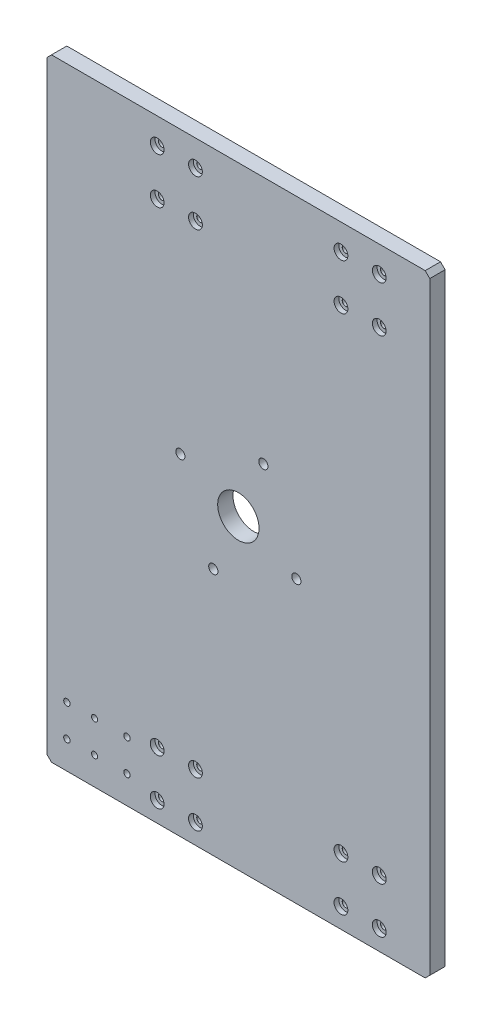
from build123d import *

# Parameters (mm, degrees)
ESQUISSE1_W                     = 250
ESQUISSE1_H                     = 400
BOSS_EXTRU_1_DEPTH              = 10
ESQUISSE2_R                     = 13.5
ENL_V_MAT_EXTRU_1_DEPTH         = 237.061432682
CHANFREIN1_SIZE                 = 3
TROU_TARAUD_M51_D               = 4.2
TROUS_DE_CENTRAGE_4_0MM2_D      = 4
TROUS_DE_CENTRAGE_6_0MM2_D      = 6
D_GAGEMENT_M41_D                = 4.5
R_P_TITION_LIN_AIRE1_COUNT      = 2
R_P_TITION_LIN_AIRE1_PITCH      = 120
R_P_TITION_LIN_AIRE1_COUNT_DIR2 = 2
R_P_TITION_LIN_AIRE1_PITCH_DIR2 = 340
R_P_TITION_LIN_AIRE2_COUNT      = 2
R_P_TITION_LIN_AIRE2_PITCH      = 30
R_P_TITION_LIN_AIRE2_COUNT_DIR2 = 2
R_P_TITION_LIN_AIRE2_PITCH_DIR2 = 25
R_P_TITION_LIN_AIRE3_COUNT      = 2
R_P_TITION_LIN_AIRE3_PITCH      = 120
R_P_TITION_LIN_AIRE3_COUNT_DIR2 = 2
R_P_TITION_LIN_AIRE3_PITCH_DIR2 = 340


with BuildPart() as part:
    # Esquisse1 → Boss.-Extru.1 (new body)
    with BuildSketch(Plane.XY):
        Rectangle(ESQUISSE1_W, ESQUISSE1_H)
    extrude(amount=BOSS_EXTRU_1_DEPTH)

    # Esquisse2 → Enlèv. mat.-Extru.1 (cut, through all)
    with BuildSketch(Plane(origin=(0, 0, 0), x_dir=(-1, 0, 0), z_dir=(0, 0, -1))):
        Circle(ESQUISSE2_R)
    extrude(amount=-ENL_V_MAT_EXTRU_1_DEPTH, mode=Mode.SUBTRACT)

    # Chanfrein1
    chanfrein1_edges = [part.edges().sort_by_distance(p)[0] for p in [
        (125, -200, 5),
        (-125, -200, 5),
        (-125, 200, 5),
        (125, 200, 5),
    ]]
    chamfer(chanfrein1_edges, length=CHANFREIN1_SIZE)

    # Trou taraudé M51 (through all)
    with Locations(Plane.XY.offset(10)):
        with Locations((-72.698486264, -161.07971462), (-72.698486264, -181.838730229), (-111.937151978, -181.838730229), (-111.937151978, -161.07971462)):
            Hole(TROU_TARAUD_M51_D / 2)

    # Trous de centrage Ø4.0mm2 (through all)
    with Locations(Plane.XY.offset(10)):
        with Locations((-93.86308218, -161.07971462), (-93.86308218, -181.838730229)):
            Hole(TROUS_DE_CENTRAGE_4_0MM2_D / 2)

    # Trous de centrage Ø6.0mm2 (through all)
    with Locations(Plane.XY.offset(10)):
        with Locations((16.357059687, 37.86831259), (37.86831259, -16.357059687), (-16.357059687, -37.86831259), (-37.86831259, 16.357059687)):
            Hole(TROUS_DE_CENTRAGE_6_0MM2_D / 2)

    # Dégagement M41 (through all)
    with Locations(Plane(origin=(0, 0, 0), x_dir=(-1, 0, 0), z_dir=(0, 0, -1))):
        with Locations((28, -187), (28, -157), (53, -157), (53, -187)):
            d_gagement_m41 = Hole(D_GAGEMENT_M41_D / 2)

    # Répétition linéaire1: D_gagement M41 2 × 2
    with Locations(*[(i * R_P_TITION_LIN_AIRE1_PITCH, j * R_P_TITION_LIN_AIRE1_PITCH_DIR2, 0) for i in range(R_P_TITION_LIN_AIRE1_COUNT) for j in range(R_P_TITION_LIN_AIRE1_COUNT_DIR2) if (i, j) != (0, 0)]):
        add(d_gagement_m41, mode=Mode.SUBTRACT)

    # Esquisse29 → Chambrage pour vis à tête ronde bombée M41 (revolve, cut)
    with BuildSketch(Plane(origin=(92, -157, 10), x_dir=(0, -1, 0), z_dir=(1, 0, 0))):
        Polygon((0, 0), (0, 10), (2.25, 10), (2.25, 3.125), (2.275, 3.1), (4.5, 3.1), (4.5, 0), align=None)
    chambrage_pour_vis_t_te_ronde_bomb_e_m = revolve(axis=Axis((92, -157, 16.35), (0, 0, -1)), mode=Mode.SUBTRACT)

    # Répétition linéaire2: Chambrage pour vis _ t_te ronde bomb_e M 2 × 2
    with Locations(*[(-j * R_P_TITION_LIN_AIRE2_PITCH_DIR2, -i * R_P_TITION_LIN_AIRE2_PITCH, 0) for i in range(R_P_TITION_LIN_AIRE2_COUNT) for j in range(R_P_TITION_LIN_AIRE2_COUNT_DIR2) if (i, j) != (0, 0)]):
        add(chambrage_pour_vis_t_te_ronde_bomb_e_m, mode=Mode.SUBTRACT)

    # Répétition linéaire3: Chambrage pour vis _ t_te ronde bomb_e M 2 × 2
    with Locations(*[(-i * R_P_TITION_LIN_AIRE3_PITCH, j * R_P_TITION_LIN_AIRE3_PITCH_DIR2, 0) for i in range(R_P_TITION_LIN_AIRE3_COUNT) for j in range(R_P_TITION_LIN_AIRE3_COUNT_DIR2) if (i, j) != (0, 0)]):
        add(chambrage_pour_vis_t_te_ronde_bomb_e_m, mode=Mode.SUBTRACT)

    # Répétition linéaire3 copy 1 sketch → Répétition linéaire3 copy 1 (revolve, cut)
    with BuildSketch(Plane(origin=(67, 183, 10), x_dir=(0, -1, 0), z_dir=(1, 0, 0))):
        Polygon((0, 0), (0, 10), (2.25, 10), (2.25, 3.125), (2.275, 3.1), (4.5, 3.1), (4.5, 0), align=None)
    revolve(axis=Axis((67, 183, 16.35), (0, 0, -1)), mode=Mode.SUBTRACT)

    # Répétition linéaire3 copy 2 sketch → Répétition linéaire3 copy 2 (revolve, cut)
    with BuildSketch(Plane(origin=(-53, -157, 10), x_dir=(0, -1, 0), z_dir=(1, 0, 0))):
        Polygon((0, 0), (0, 10), (2.25, 10), (2.25, 3.125), (2.275, 3.1), (4.5, 3.1), (4.5, 0), align=None)
    revolve(axis=Axis((-53, -157, 16.35), (0, 0, -1)), mode=Mode.SUBTRACT)

    # Répétition linéaire3 copy 3 sketch → Répétition linéaire3 copy 3 (revolve, cut)
    with BuildSketch(Plane(origin=(-53, 183, 10), x_dir=(0, -1, 0), z_dir=(1, 0, 0))):
        Polygon((0, 0), (0, 10), (2.25, 10), (2.25, 3.125), (2.275, 3.1), (4.5, 3.1), (4.5, 0), align=None)
    revolve(axis=Axis((-53, 183, 16.35), (0, 0, -1)), mode=Mode.SUBTRACT)

    # Répétition linéaire3 copy 4 sketch → Répétition linéaire3 copy 4 (revolve, cut)
    with BuildSketch(Plane(origin=(92, 153, 10), x_dir=(0, -1, 0), z_dir=(1, 0, 0))):
        Polygon((0, 0), (0, 10), (2.25, 10), (2.25, 3.125), (2.275, 3.1), (4.5, 3.1), (4.5, 0), align=None)
    revolve(axis=Axis((92, 153, 16.35), (0, 0, -1)), mode=Mode.SUBTRACT)

    # Répétition linéaire3 copy 5 sketch → Répétition linéaire3 copy 5 (revolve, cut)
    with BuildSketch(Plane(origin=(-28, -187, 10), x_dir=(0, -1, 0), z_dir=(1, 0, 0))):
        Polygon((0, 0), (0, 10), (2.25, 10), (2.25, 3.125), (2.275, 3.1), (4.5, 3.1), (4.5, 0), align=None)
    revolve(axis=Axis((-28, -187, 16.35), (0, 0, -1)), mode=Mode.SUBTRACT)

    # Répétition linéaire3 copy 6 sketch → Répétition linéaire3 copy 6 (revolve, cut)
    with BuildSketch(Plane(origin=(-28, 153, 10), x_dir=(0, -1, 0), z_dir=(1, 0, 0))):
        Polygon((0, 0), (0, 10), (2.25, 10), (2.25, 3.125), (2.275, 3.1), (4.5, 3.1), (4.5, 0), align=None)
    revolve(axis=Axis((-28, 153, 16.35), (0, 0, -1)), mode=Mode.SUBTRACT)

    # Répétition linéaire3 copy 7 sketch → Répétition linéaire3 copy 7 (revolve, cut)
    with BuildSketch(Plane(origin=(67, 153, 10), x_dir=(0, -1, 0), z_dir=(1, 0, 0))):
        Polygon((0, 0), (0, 10), (2.25, 10), (2.25, 3.125), (2.275, 3.1), (4.5, 3.1), (4.5, 0), align=None)
    revolve(axis=Axis((67, 153, 16.35), (0, 0, -1)), mode=Mode.SUBTRACT)

    # Répétition linéaire3 copy 8 sketch → Répétition linéaire3 copy 8 (revolve, cut)
    with BuildSketch(Plane(origin=(-53, -187, 10), x_dir=(0, -1, 0), z_dir=(1, 0, 0))):
        Polygon((0, 0), (0, 10), (2.25, 10), (2.25, 3.125), (2.275, 3.1), (4.5, 3.1), (4.5, 0), align=None)
    revolve(axis=Axis((-53, -187, 16.35), (0, 0, -1)), mode=Mode.SUBTRACT)

    # Répétition linéaire3 copy 9 sketch → Répétition linéaire3 copy 9 (revolve, cut)
    with BuildSketch(Plane(origin=(-53, 153, 10), x_dir=(0, -1, 0), z_dir=(1, 0, 0))):
        Polygon((0, 0), (0, 10), (2.25, 10), (2.25, 3.125), (2.275, 3.1), (4.5, 3.1), (4.5, 0), align=None)
    revolve(axis=Axis((-53, 153, 16.35), (0, 0, -1)), mode=Mode.SUBTRACT)


solid = part.part
